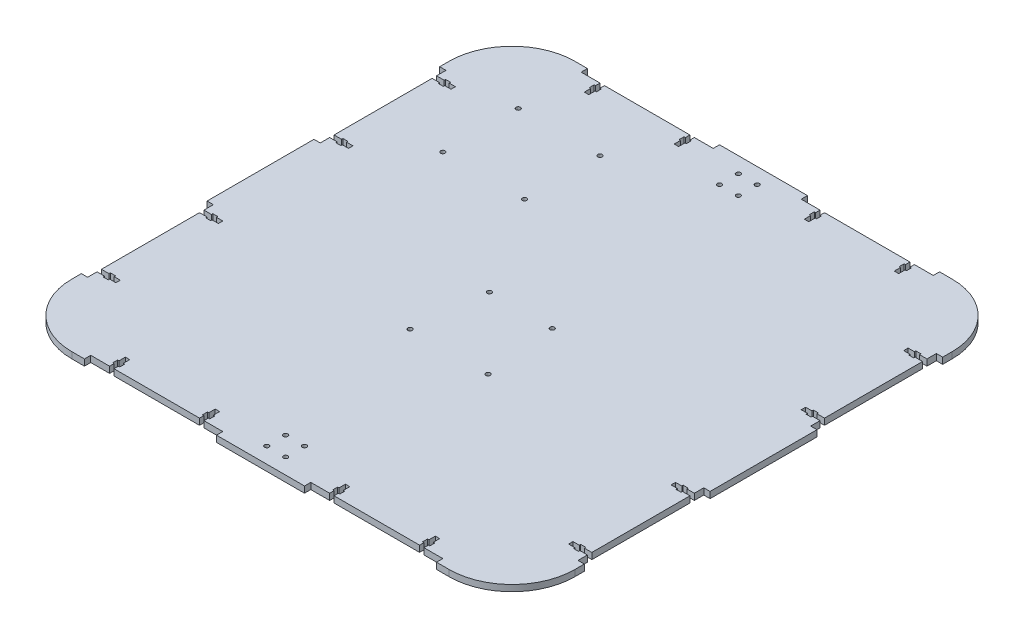
from build123d import *

# Parameters (mm, degrees)
SKETCH1_W           = 400
SKETCH1_H           = 400
SKETCH1_R           = 1.75
BOSS_EXTRUDE2_DEPTH = 5
FILLET1_R           = 50
CUT_EXTRUDE8_DEPTH  = 10
SKETCH11_W          = 105
SKETCH11_H          = 5
CUT_EXTRUDE9_DEPTH  = 10
CUT_EXTRUDE10_DEPTH = 5
SKETCH13_W          = 5
SKETCH13_H          = 100
CUT_EXTRUDE11_DEPTH = 5
SKETCH14_R          = 1.75
CUT_EXTRUDE12_DEPTH = 10
SKETCH15_R          = 1.75
CUT_EXTRUDE13_DEPTH = 10


with BuildPart() as part:
    # Sketch1 → Boss-Extrude2 (new body)
    with BuildSketch(Plane(origin=(0, 0, 0), x_dir=(1, 0, 0), z_dir=(0, 1, 0))):
        Rectangle(SKETCH1_W, SKETCH1_H)
        with Locations(Location((-7.5, 187.5, 0), (0, 0, 270))):
            Circle(SKETCH1_R, mode=Mode.SUBTRACT)
        with Locations(Location((7.5, 187.5, 0), (0, 0, 270))):
            Circle(SKETCH1_R, mode=Mode.SUBTRACT)
        with Locations(Location((7.5, 172.5, 0), (0, 0, 270))):
            Circle(SKETCH1_R, mode=Mode.SUBTRACT)
        with Locations(Location((-7.5, 172.5, 0), (0, 0, 270))):
            Circle(SKETCH1_R, mode=Mode.SUBTRACT)
        with Locations(Location((7.5, -187.5, 0), (0, 0, 270))):
            Circle(SKETCH1_R, mode=Mode.SUBTRACT)
        with Locations(Location((-7.5, -187.5, 0), (0, 0, 270))):
            Circle(SKETCH1_R, mode=Mode.SUBTRACT)
        with Locations(Location((-7.5, -172.5, 0), (0, 0, 270))):
            Circle(SKETCH1_R, mode=Mode.SUBTRACT)
        with Locations(Location((7.5, -172.5, 0), (0, 0, 270))):
            Circle(SKETCH1_R, mode=Mode.SUBTRACT)
    extrude(amount=BOSS_EXTRUDE2_DEPTH)

    # Fillet1
    fillet1_edges = [part.edges().sort_by_distance(p)[0] for p in [
        (200, 2.5, 200),
        (-200, 2.5, 200),
        (-200, 2.5, -200),
        (200, 2.5, -200),
    ]]
    fillet(fillet1_edges, radius=FILLET1_R)

    # Sketch10 → Cut-Extrude8 (cut)
    with BuildSketch(Plane(origin=(0, 5, 0), x_dir=(1, 0, 0), z_dir=(0, 1, 0))):
        Polygon((-125, -200), (-121.5, -200), (-121.5, -191.5), (-120.4, -191.5), (-120.4, -187.5), (-121.5, -187.5), (-121.5, -182.5), (-125, -182.5), (-125, -187.5), (-126.1, -187.5), (-126.1, -191.5), (-125, -191.5), align=None)
        Polygon((-53.5, -200), (-50, -200), (-50, -191.5), (-48.9, -191.5), (-48.9, -187.5), (-50, -187.5), (-50, -182.5), (-53.5, -182.5), (-53.5, -187.5), (-54.6, -187.5), (-54.6, -191.5), (-53.5, -191.5), align=None)
        Polygon((125, -200), (125, -191.5), (126.1, -191.5), (126.1, -187.5), (125, -187.5), (125, -182.5), (121.5, -182.5), (121.5, -187.5), (120.4, -187.5), (120.4, -191.5), (121.5, -191.5), (121.5, -200), align=None)
        Polygon((53.5, -200), (53.5, -191.5), (54.6, -191.5), (54.6, -187.5), (53.5, -187.5), (53.5, -182.5), (50, -182.5), (50, -187.5), (48.9, -187.5), (48.9, -191.5), (50, -191.5), (50, -200), align=None)
        Polygon((125, 200), (121.5, 200), (121.5, 191.5), (120.4, 191.5), (120.4, 187.5), (121.5, 187.5), (121.5, 182.5), (125, 182.5), (125, 187.5), (126.1, 187.5), (126.1, 191.5), (125, 191.5), align=None)
        Polygon((53.5, 200), (50, 200), (50, 191.5), (48.9, 191.5), (48.9, 187.5), (50, 187.5), (50, 182.5), (53.5, 182.5), (53.5, 187.5), (54.6, 187.5), (54.6, 191.5), (53.5, 191.5), align=None)
        Polygon((-53.5, 200), (-53.5, 191.5), (-54.6, 191.5), (-54.6, 187.5), (-53.5, 187.5), (-53.5, 182.5), (-50, 182.5), (-50, 187.5), (-48.9, 187.5), (-48.9, 191.5), (-50, 191.5), (-50, 200), align=None)
        Polygon((-125, 200), (-125, 191.5), (-126.1, 191.5), (-126.1, 187.5), (-125, 187.5), (-125, 182.5), (-121.5, 182.5), (-121.5, 187.5), (-120.4, 187.5), (-120.4, 191.5), (-121.5, 191.5), (-121.5, 200), align=None)
    extrude(amount=-CUT_EXTRUDE8_DEPTH, mode=Mode.SUBTRACT)

    # Sketch11 → Cut-Extrude9 (cut)
    with BuildSketch(Plane(origin=(0, 5, 0), x_dir=(1, 0, 0), z_dir=(0, 1, 0))):
        with Locations((-87.5, -197.5)):
            Rectangle(SKETCH11_W, SKETCH11_H)
        with Locations((87.5, -197.5)):
            Rectangle(SKETCH11_W, SKETCH11_H)
        with Locations((87.5, 197.5)):
            Rectangle(SKETCH11_W, SKETCH11_H)
        with Locations((-87.5, 197.5)):
            Rectangle(SKETCH11_W, SKETCH11_H)
    extrude(amount=-CUT_EXTRUDE9_DEPTH, mode=Mode.SUBTRACT)

    # Sketch12 → Cut-Extrude10 (cut)
    with BuildSketch(Plane(origin=(0, 5, 0), x_dir=(1, 0, 0), z_dir=(0, 1, 0))):
        Polygon((-200, 135), (-189, 135), (-189, 136.1), (-185, 136.1), (-185, 135), (-180, 135), (-180, 131.5), (-185, 131.5), (-185, 130.4), (-189, 130.4), (-189, 131.5), (-200, 131.5), align=None)
        Polygon((-200, 53.5), (-189, 53.5), (-189, 54.6), (-185, 54.6), (-185, 53.5), (-180, 53.5), (-180, 50), (-185, 50), (-185, 48.9), (-189, 48.9), (-189, 50), (-200, 50), align=None)
        Polygon((-200, -53.5), (-200, -50), (-189, -50), (-189, -48.9), (-185, -48.9), (-185, -50), (-180, -50), (-180, -53.5), (-185, -53.5), (-185, -54.6), (-189, -54.6), (-189, -53.5), align=None)
        Polygon((-200, -135), (-200, -131.5), (-189, -131.5), (-189, -130.4), (-185, -130.4), (-185, -131.5), (-180, -131.5), (-180, -135), (-185, -135), (-185, -136.1), (-189, -136.1), (-189, -135), align=None)
        Polygon((200, -135), (189, -135), (189, -136.1), (185, -136.1), (185, -135), (180, -135), (180, -131.5), (185, -131.5), (185, -130.4), (189, -130.4), (189, -131.5), (200, -131.5), align=None)
        Polygon((200, -53.5), (189, -53.5), (189, -54.6), (185, -54.6), (185, -53.5), (180, -53.5), (180, -50), (185, -50), (185, -48.9), (189, -48.9), (189, -50), (200, -50), align=None)
        Polygon((200, 53.5), (200, 50), (189, 50), (189, 48.9), (185, 48.9), (185, 50), (180, 50), (180, 53.5), (185, 53.5), (185, 54.6), (189, 54.6), (189, 53.5), align=None)
        Polygon((200, 135), (200, 131.5), (189, 131.5), (189, 130.4), (185, 130.4), (185, 131.5), (180, 131.5), (180, 135), (185, 135), (185, 136.1), (189, 136.1), (189, 135), align=None)
    extrude(amount=-CUT_EXTRUDE10_DEPTH, mode=Mode.SUBTRACT)

    # Sketch13 → Cut-Extrude11 (cut)
    with BuildSketch(Plane(origin=(0, 5, 0), x_dir=(1, 0, 0), z_dir=(0, 1, 0))):
        with Locations((-197.5, 92.5)):
            Rectangle(SKETCH13_W, SKETCH13_H)
        with Locations((-197.5, -92.5)):
            Rectangle(SKETCH13_W, SKETCH13_H)
        with Locations((197.5, -92.5)):
            Rectangle(SKETCH13_W, SKETCH13_H)
        with Locations((197.5, 92.5)):
            Rectangle(SKETCH13_W, SKETCH13_H)
    extrude(amount=-CUT_EXTRUDE11_DEPTH, mode=Mode.SUBTRACT)

    # Sketch14 → Cut-Extrude12 (cut)
    with BuildSketch(Plane(origin=(0, 5, 0), x_dir=(1, 0, 0), z_dir=(0, 1, 0))):
        with Locations(Location((-31, -50, 0), (0, 0, 270))):
            Circle(SKETCH14_R)
        with Locations(Location((31, -50, 0), (0, 0, 270))):
            Circle(SKETCH14_R)
        with Locations(Location((-25, 7, 0), (0, 0, 270))):
            Circle(SKETCH14_R)
        with Locations(Location((25, 7, 0), (0, 0, 270))):
            Circle(SKETCH14_R)
    extrude(amount=-CUT_EXTRUDE12_DEPTH, mode=Mode.SUBTRACT)

    # Sketch15 → Cut-Extrude13 (cut)
    with BuildSketch(Plane(origin=(0, 5, 0), x_dir=(1, 0, 0), z_dir=(0, 1, 0))):
        with Locations(Location((-140, 145, 0), (0, 0, 270))):
            Circle(SKETCH15_R)
        with Locations(Location((-75, 145, 0), (0, 0, 270))):
            Circle(SKETCH15_R)
        with Locations(Location((-140, 85, 0), (0, 0, 270))):
            Circle(SKETCH15_R)
        with Locations(Location((-75, 85, 0), (0, 0, 270))):
            Circle(SKETCH15_R)
    extrude(amount=-CUT_EXTRUDE13_DEPTH, mode=Mode.SUBTRACT)


solid = part.part
